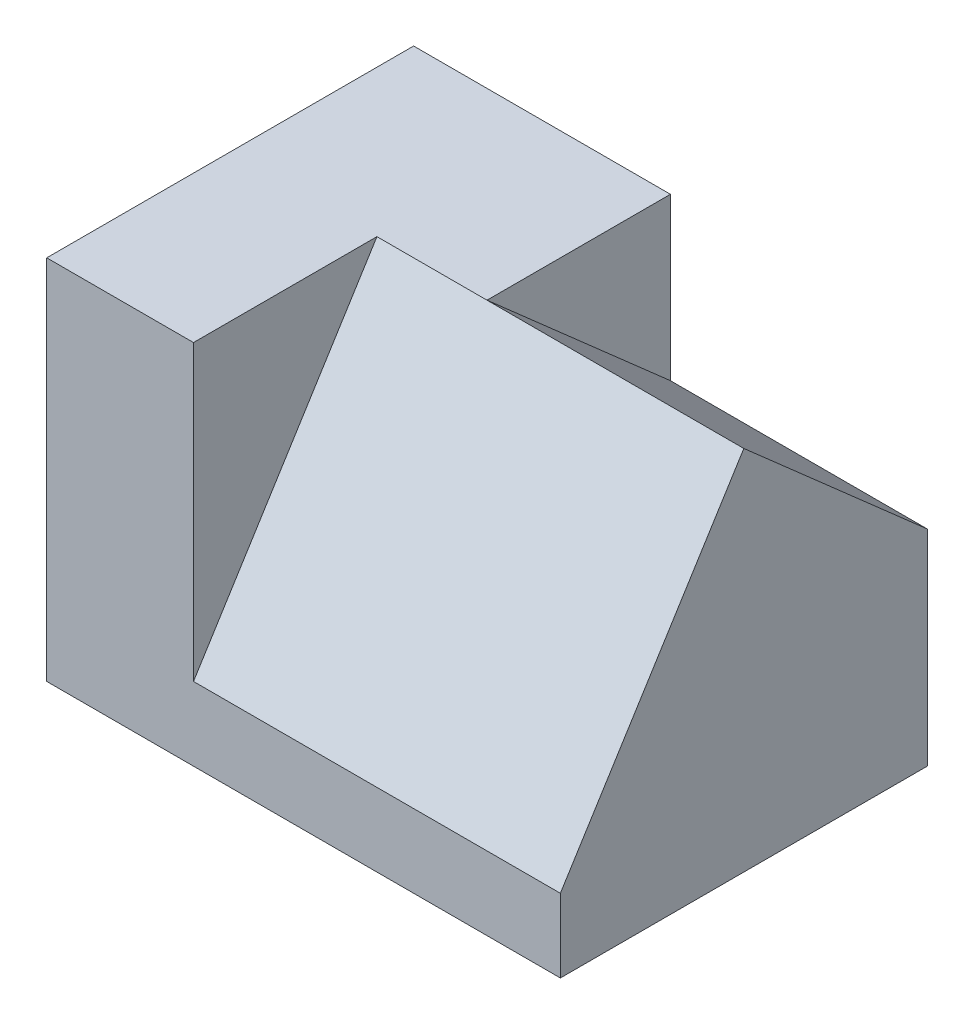
from build123d import *

# Parameters (mm, degrees)
SKETCH1_W           = 70
SKETCH1_H           = 50
BOSS_EXTRUDE1_DEPTH = 10
BOSS_EXTRUDE2_DEPTH = 40
SKETCH2_3_W         = 35
SKETCH2_3_H         = 25
BOSS_EXTRUDE3_DEPTH = 18
BOSS_EXTRUDE5_DEPTH = 40
SKETCH10_W          = 50
SKETCH10_H          = 47.16990566
CUT_EXTRUDE1_DEPTH  = 101.481984522
SKETCH12_W          = 35
SKETCH12_H          = 25
BOSS_EXTRUDE6_DEPTH = 22
SKETCH13_W          = 35
SKETCH13_H          = 35.129704137
CUT_EXTRUDE2_DEPTH  = 89.439532715


with BuildPart() as part:
    # Sketch1 → Boss-Extrude1 (new body)
    with BuildSketch(Plane(origin=(0, 0, 0), x_dir=(1, 0, 0), z_dir=(0, 1, 0))):
        with Locations((35, 25)):
            Rectangle(SKETCH1_W, SKETCH1_H)
    extrude(amount=BOSS_EXTRUDE1_DEPTH)

    # Sketch2 → Boss-Extrude2 (add)
    with BuildSketch(Plane(origin=(0, 10, 0), x_dir=(1, 0, 0), z_dir=(0, 1, 0))):
        Polygon((0, 0), (20, 0), (20, 25), (35, 25), (35, 50), (0, 50), align=None)
    extrude(amount=BOSS_EXTRUDE2_DEPTH)

    # Sketch2<3> → Boss-Extrude3 (add)
    with BuildSketch(Plane(origin=(0, 10, 0), x_dir=(1, 0, 0), z_dir=(0, 1, 0))):
        with Locations((52.5, 37.5)):
            Rectangle(SKETCH2_3_W, SKETCH2_3_H)
    extrude(amount=BOSS_EXTRUDE3_DEPTH)



with BuildPart() as body_2:
    # Sketch2<5> → Boss-Extrude5 (new body)
    with BuildSketch(Plane(origin=(0, 10, 0), x_dir=(1, 0, 0), z_dir=(0, 1, 0))):
        Polygon((20, 0), (70, 0), (70, 25), (35, 25), (20, 25), align=None)
    extrude(amount=BOSS_EXTRUDE5_DEPTH)

    # Sketch10 → Cut-Extrude1 (cut, through all)
    with BuildSketch(Plane(origin=(0, 2.808988764, 4.494382022), x_dir=(1, 0, 0), z_dir=(0, 0.52999894000318, 0.8479983040050879))):
        with Locations((45, 32.06493587)):
            Rectangle(SKETCH10_W, SKETCH10_H)
    extrude(amount=CUT_EXTRUDE1_DEPTH, mode=Mode.SUBTRACT)


with BuildPart() as part_1:
    add(part.part)

    add(body_2.part)  # Boss-Extrude6 merges body 2
    # Sketch12 → Boss-Extrude6 (add)
    with BuildSketch(Plane(origin=(0, 28, 0), x_dir=(1, 0, 0), z_dir=(0, 1, 0))):
        with Locations((52.5, 37.5)):
            Rectangle(SKETCH12_W, SKETCH12_H)
    extrude(amount=BOSS_EXTRUDE6_DEPTH)

    # Sketch13 → Cut-Extrude2 (cut, through all)
    with BuildSketch(Plane(origin=(0, 40.577096483, -35.707844905), x_dir=(-1, 0, 0), z_dir=(0, -0.7507135169227553, 0.6606278948920248))):
        with Locations((-52.5, 3.301295247)):
            Rectangle(SKETCH13_W, SKETCH13_H)
    extrude(amount=-CUT_EXTRUDE2_DEPTH, mode=Mode.SUBTRACT)


solid = part_1.part
